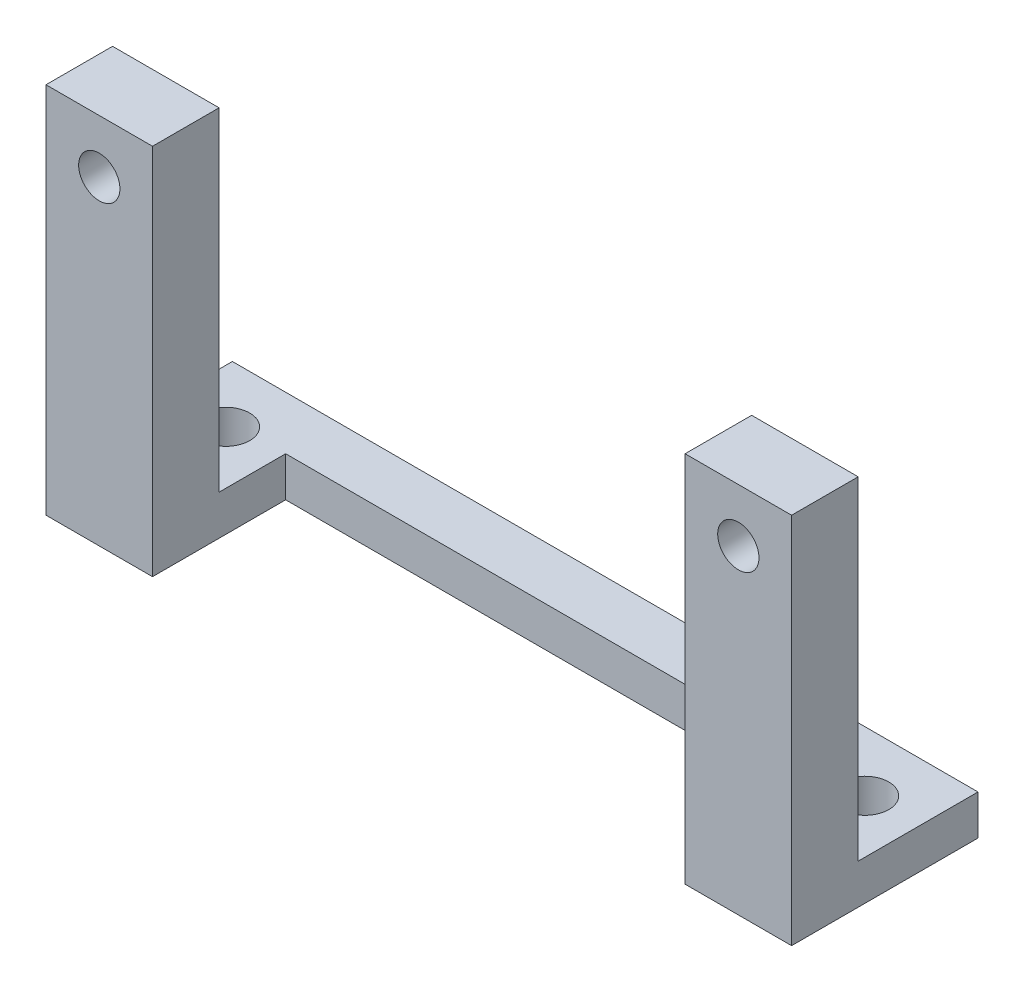
from build123d import *

# Parameters (mm, degrees)
SKETCH_1_W               = 56
SKETCH_1_H               = 14
F_56X14_3_3MM_DEPTH      = 3
SKETCH_2_W               = 40
SKETCH_2_H               = 11
CUT_EXTRUDE_40_4_3_DEPTH = 3
SKETCH_3_W               = 8
SKETCH_3_H               = 25
F_5_M2_5X10_DEPTH        = 5
SKETCH_4_R               = 1.55
CUT_EXTRUDE_3_1_48_DEPTH = 5
SKETCH_5_R               = 1.8
CUT_EXTRUDE_993_DEPTH    = 3


with BuildPart() as part:
    # 草图1 → 相机小底脚56x14_厚3_单向3mm (new body)
    with BuildSketch(Plane(origin=(0, 0, 0), x_dir=(1, 0, 0), z_dir=(0, 1, 0))):
        with Locations((0, 2)):
            Rectangle(SKETCH_1_W, SKETCH_1_H)
    extrude(amount=F_56X14_3_3MM_DEPTH)

    # 草图2 → 底脚中央40宽镂空_只留后横梁4_贯穿底脚3 (cut)
    with BuildSketch(Plane(origin=(0, 0, 0), x_dir=(1, 0, 0), z_dir=(0, 1, 0))):
        with Locations((0, -0.5)):
            Rectangle(SKETCH_2_W, SKETCH_2_H)
    extrude(amount=CUT_EXTRUDE_40_4_3_DEPTH, mode=Mode.SUBTRACT)

    # 草图3 → 双耳支撑臂厚5_沿用M2.5x10尺寸链 (add)
    with BuildSketch(Plane.XY):
        with Locations((-24, 15.5)):
            Rectangle(SKETCH_3_W, SKETCH_3_H)
        with Locations((24, 15.5)):
            Rectangle(SKETCH_3_W, SKETCH_3_H)
    extrude(amount=F_5_M2_5X10_DEPTH)

    # 草图4 → 双耳原孔3.1_孔距48_圆孔不加大_贯穿 (cut)
    with BuildSketch(Plane.XY):
        with Locations((-24, 24)):
            Circle(SKETCH_4_R)
        with Locations((24, 24)):
            Circle(SKETCH_4_R)
    extrude(amount=CUT_EXTRUDE_3_1_48_DEPTH, mode=Mode.SUBTRACT)

    # 草图5 → Cut-Extrude 993 (cut)
    with BuildSketch(Plane(origin=(0, 0, 0), x_dir=(1, 0, 0), z_dir=(0, 1, 0))):
        with Locations(Location((-24, 4.5, 0), (0, 0, 270))):
            Circle(SKETCH_5_R)
        with Locations(Location((24, 4.5, 0), (0, 0, 270))):
            Circle(SKETCH_5_R)
    extrude(amount=CUT_EXTRUDE_993_DEPTH, mode=Mode.SUBTRACT)


solid = part.part
